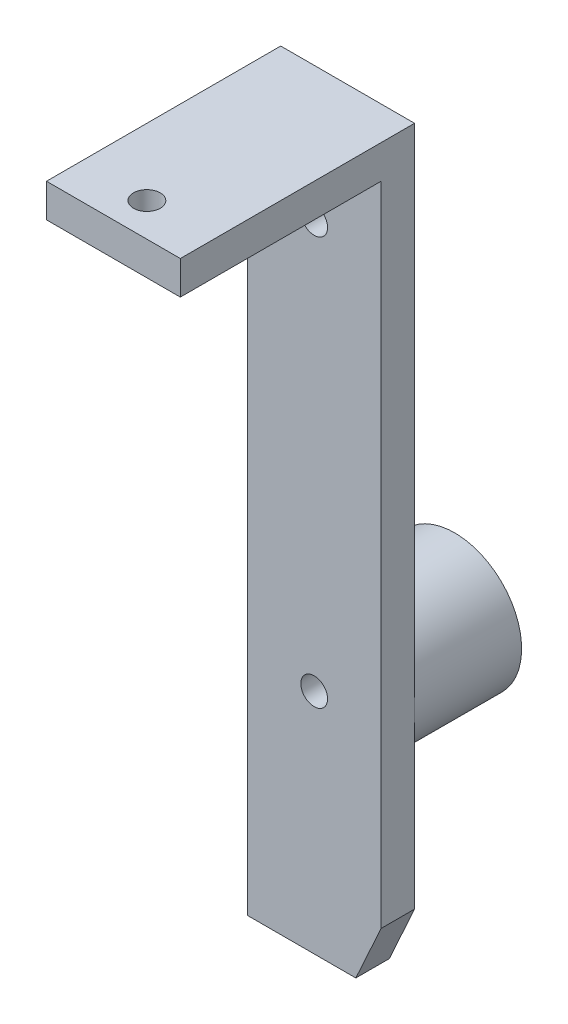
from build123d import *

# Parameters (mm, degrees)
SKETCH1_W           = 12.7
SKETCH1_H           = 3.175
BOSS_EXTRUDE1_DEPTH = 69.85
SKETCH2_W           = 12.7
SKETCH2_H           = 3.175
BOSS_EXTRUDE2_DEPTH = 19.05
SKETCH3_R           = 1.27
CUT_EXTRUDE1_DEPTH  = 71.084124673
SKETCH4_R           = 1.27
CUT_EXTRUDE2_DEPTH  = 73.679071953
SKETCH5_R           = 6.35
SKETCH5_R_2         = 1.27
BOSS_EXTRUDE3_DEPTH = 10.16
CUT_EXTRUDE3_DEPTH  = 73.679071953


with BuildPart() as part:
    # Sketch1 → Boss-Extrude1 (new body)
    with BuildSketch(Plane(origin=(0, 0, 0), x_dir=(1, 0, 0), z_dir=(0, 1, 0))):
        Rectangle(SKETCH1_W, SKETCH1_H)
    extrude(amount=BOSS_EXTRUDE1_DEPTH)

    # Sketch2 → Boss-Extrude2 (add)
    with BuildSketch(Plane.XY.offset(1.5875)):
        with Locations((0, 68.2625)):
            Rectangle(SKETCH2_W, SKETCH2_H)
    extrude(amount=BOSS_EXTRUDE2_DEPTH)

    # Sketch3 → Cut-Extrude1 (cut, through all)
    with BuildSketch(Plane.XZ.offset(-66.675)):
        with Locations(Location((0, 17.4625, 0), (0, 0, 270))):
            Circle(SKETCH3_R)
    extrude(amount=-CUT_EXTRUDE1_DEPTH, mode=Mode.SUBTRACT)

    # Sketch4 → Cut-Extrude2 (cut, through all)
    with BuildSketch(Plane.XY.offset(1.5875)):
        with Locations((0, 21.59)):
            Circle(SKETCH4_R)
        with Locations((0, 60.325)):
            Circle(SKETCH4_R)
    extrude(amount=-CUT_EXTRUDE2_DEPTH, mode=Mode.SUBTRACT)

    # Sketch5 → Boss-Extrude3 (add)
    with BuildSketch(Plane(origin=(0, 0, -1.5875), x_dir=(-1, 0, 0), z_dir=(0, 0, -1))):
        with Locations((0, 21.59)):
            Circle(SKETCH5_R)
        with Locations(Location((0, 21.59, 0), (0, 0, 180))):
            Circle(SKETCH5_R_2, mode=Mode.SUBTRACT)
    extrude(amount=BOSS_EXTRUDE3_DEPTH)

    # Sketch6 → Cut-Extrude3 (cut, through all)
    with BuildSketch(Plane.XY.offset(1.5875)):
        Polygon((3.951482723, 0), (6.35, 5.27166953), (6.35, 0), align=None)
    extrude(amount=-CUT_EXTRUDE3_DEPTH, mode=Mode.SUBTRACT)


solid = part.part
